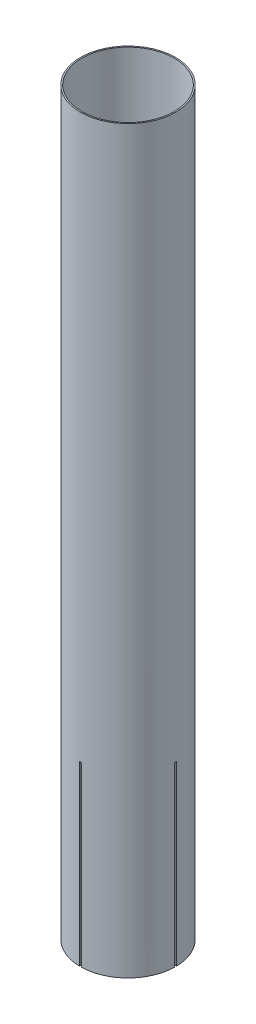
from build123d import *

# Parameters (mm, degrees)
SKETCH1_R           = 78.359
SKETCH1_R_2         = 76.2
BOSS_EXTRUDE1_DEPTH = 1219.2
SKETCH2_W           = 3.175
SKETCH2_H           = 292.1
CUT_EXTRUDE2_DEPTH  = 1225.225839362
CIRPATTERN1_COUNT   = 4


with BuildPart() as part:
    # Sketch1 → Boss-Extrude1 (new body)
    with BuildSketch(Plane(origin=(0, 0, 0), x_dir=(1, 0, 0), z_dir=(0, 1, 0))):
        with Locations(Location((0, 0, 0), (0, 0, 90))):
            Circle(SKETCH1_R)
        with Locations(Location((0, 0, 0), (0, 0, 90))):
            Circle(SKETCH1_R_2, mode=Mode.SUBTRACT)
    extrude(amount=BOSS_EXTRUDE1_DEPTH)

    # Sketch2 → Cut-Extrude2 (cut, through all)
    with BuildSketch(Plane.XY):
        with Locations((0, 146.05)):
            Rectangle(SKETCH2_W, SKETCH2_H)
    cut_extrude2 = extrude(amount=CUT_EXTRUDE2_DEPTH, mode=Mode.SUBTRACT)

    # CirPattern1: Cut-Extrude2 ×4 about axis
    cirpattern1_axis = Axis((0, 0, 0), (0, 1, 0))
    for i in range(1, CIRPATTERN1_COUNT):
        add(cut_extrude2.rotate(cirpattern1_axis, i * 360 / CIRPATTERN1_COUNT), mode=Mode.SUBTRACT)


solid = part.part
